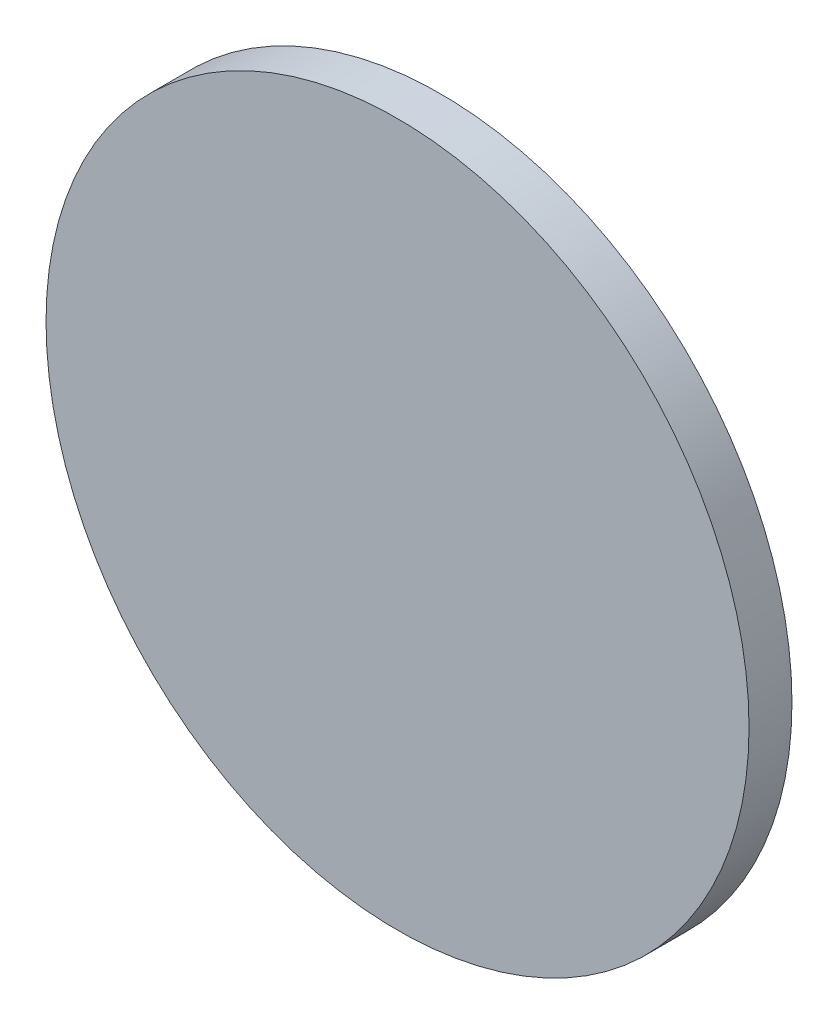
from build123d import *

# Parameters (mm, degrees)
SKETCH1_R           = 26
BOSS_EXTRUDE1_DEPTH = 3.175


with BuildPart() as part:
    # Sketch1 → Boss-Extrude1 (new body)
    with BuildSketch(Plane.XY):
        Circle(SKETCH1_R)
    extrude(amount=BOSS_EXTRUDE1_DEPTH)


solid = part.part
